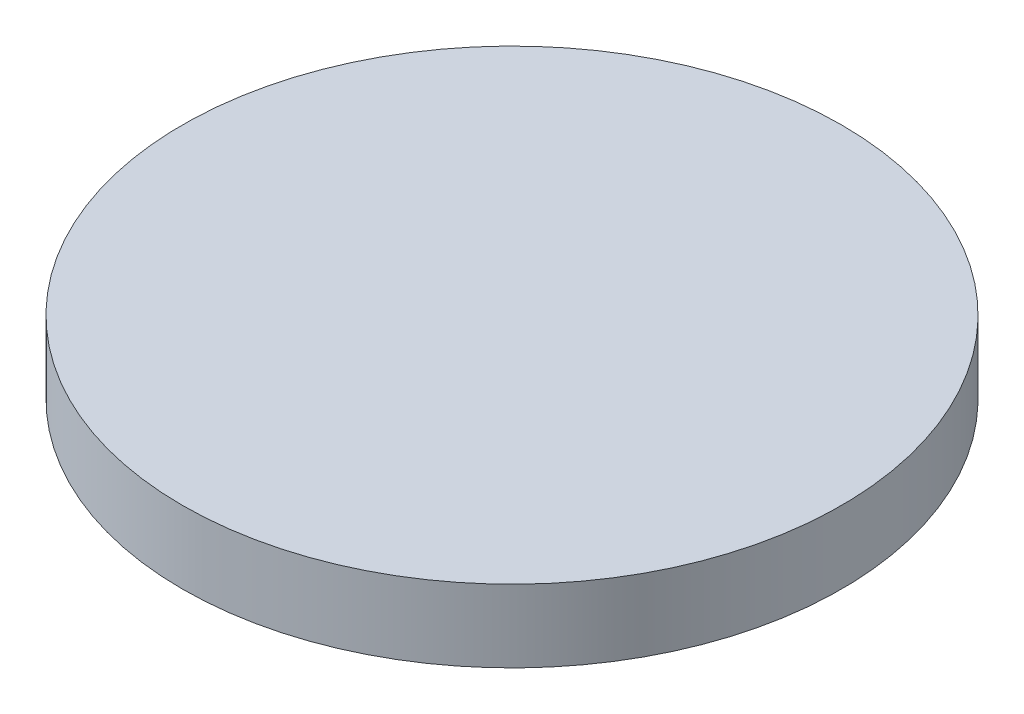
from build123d import *

# Parameters (mm, degrees)
SKETCH1_R           = 20
BOSS_EXTRUDE1_DEPTH = 4.4


with BuildPart() as part:
    # Sketch1 → Boss-Extrude1 (new body)
    with BuildSketch(Plane(origin=(0, 0, 0), x_dir=(1, 0, 0), z_dir=(0, 1, 0))):
        with Locations(Location((0, 0, 0), (0, 0, 270))):
            Circle(SKETCH1_R)
    extrude(amount=BOSS_EXTRUDE1_DEPTH)


solid = part.part
